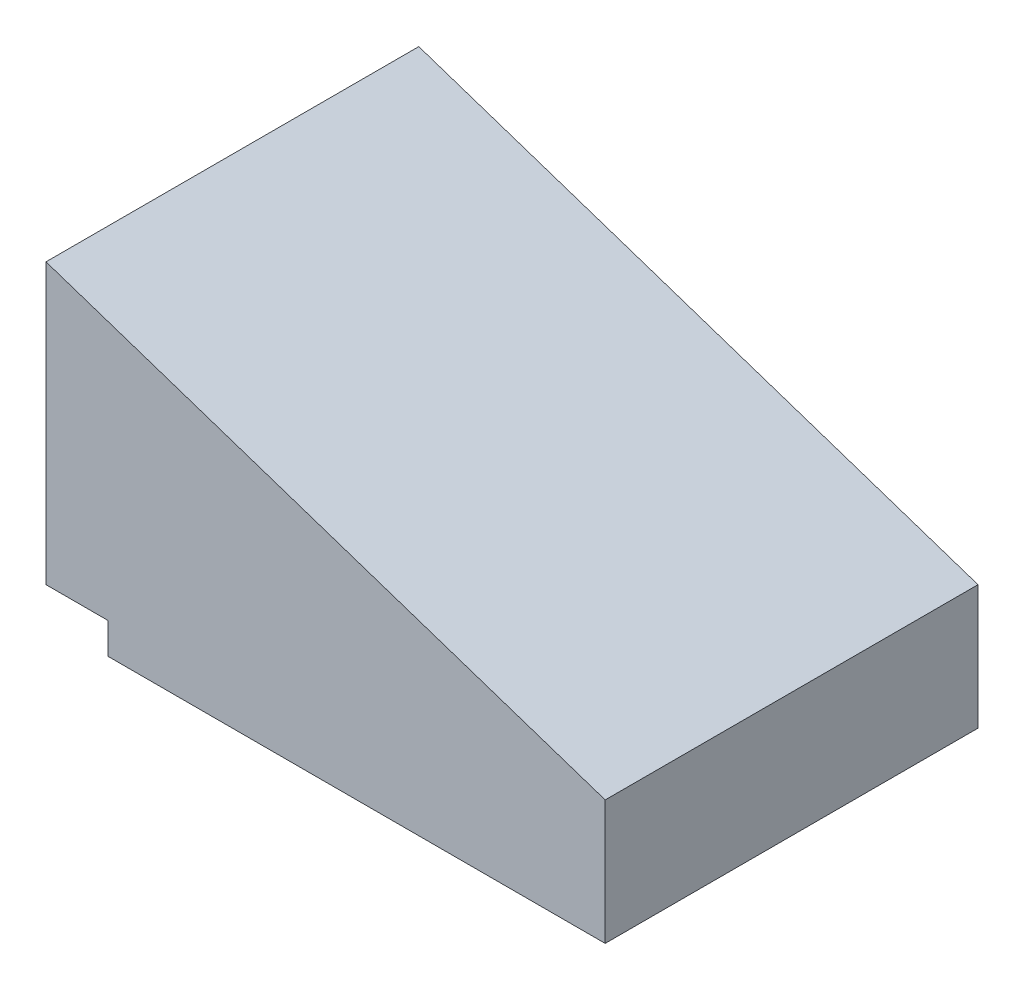
from build123d import *

# Parameters (mm, degrees)
BOSS_EXTRUDE2_DEPTH = 152.4
SHELL1_T            = -1.5875
SKETCH4_W           = 25.4
SKETCH4_H           = 12.7
CUT_EXTRUDE1_DEPTH  = 152.4


with BuildPart() as part:
    # Sketch3 → Boss-Extrude2 (new body)
    with BuildSketch(Plane.XY):
        Polygon((-228.6, 127), (0, 50.8), (0, 0), (-228.6, 0), align=None)
    extrude(amount=BOSS_EXTRUDE2_DEPTH)

    # Shell1
    shell1_openings = [part.faces().sort_by_distance(p)[0] for p in [
        (-114.3, 0, 76.2),
    ]]
    offset(amount=SHELL1_T, openings=shell1_openings, kind=Kind.INTERSECTION)

    # Sketch4 → Cut-Extrude1 (cut)
    with BuildSketch(Plane(origin=(0, 0, 0), x_dir=(-1, 0, 0), z_dir=(0, 0, -1))):
        with Locations((215.9, 6.35)):
            Rectangle(SKETCH4_W, SKETCH4_H)
    extrude(amount=-CUT_EXTRUDE1_DEPTH, mode=Mode.SUBTRACT)


solid = part.part
